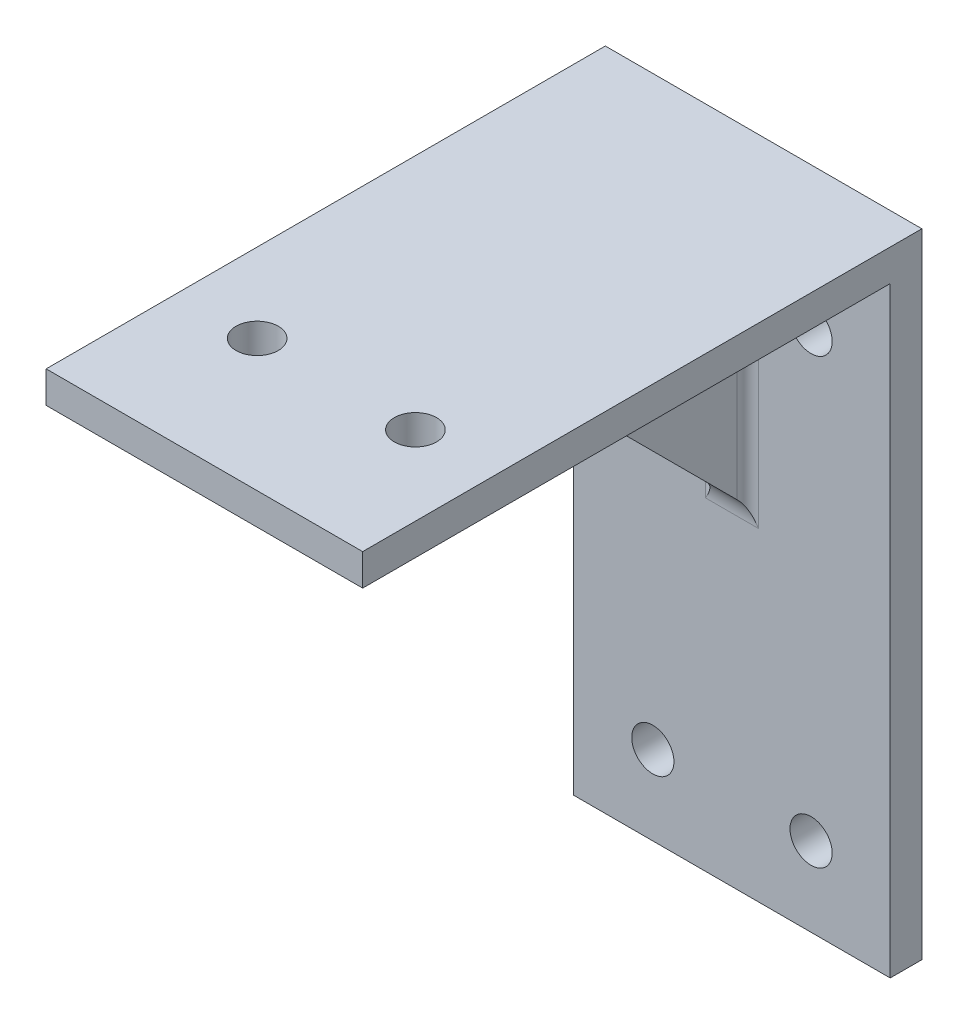
from build123d import *

# Parameters (mm, degrees)
SKETCH1_W           = 120
SKETCH1_H           = 60
BOSS_EXTRUDE1_DEPTH = 6
SKETCH2_W           = 60
SKETCH2_H           = 100
BOSS_EXTRUDE2_DEPTH = 6
BOSS_EXTRUDE3_DEPTH = 3
SKETCH5_R           = 4
CUT_EXTRUDE2_DEPTH  = 62
SKETCH6_R           = 4
CUT_EXTRUDE3_DEPTH  = 62
FILLET1_R           = 2
FILLET3_R           = 6.5


with BuildPart() as part:
    # Sketch1 → Boss-Extrude1 (new body)
    with BuildSketch(Plane(origin=(0, 0, 0), x_dir=(0, 1, 0), z_dir=(0, 0, 1))):
        Rectangle(SKETCH1_W, SKETCH1_H)
    extrude(amount=BOSS_EXTRUDE1_DEPTH)

    # Sketch2 → Boss-Extrude2 (add)
    with BuildSketch(Plane(origin=(0, 60, 0), x_dir=(-1, 0, 0), z_dir=(0, 1, 0))):
        with Locations((0, 56)):
            Rectangle(SKETCH2_W, SKETCH2_H)
    extrude(amount=-BOSS_EXTRUDE2_DEPTH)

    # Sketch4 → Boss-Extrude3 (add, symmetric)
    with BuildSketch(Plane.YZ):
        Polygon((54, 6), (4, 6), (54, 56), align=None)
    extrude(amount=BOSS_EXTRUDE3_DEPTH, both=True)

    # Sketch5 → Cut-Extrude2 (cut)
    with BuildSketch(Plane(origin=(0, 60, 0), x_dir=(-1, 0, 0), z_dir=(0, 1, 0))):
        with Locations((-15, 81)):
            Circle(SKETCH5_R)
        with Locations((15, 81)):
            Circle(SKETCH5_R)
    extrude(amount=-CUT_EXTRUDE2_DEPTH, mode=Mode.SUBTRACT)

    # Sketch6 → Cut-Extrude3 (cut)
    with BuildSketch(Plane.XY.offset(6)):
        with Locations((-15, -45)):
            Circle(SKETCH6_R)
        with Locations((15, -45)):
            Circle(SKETCH6_R)
        with Locations((-15, 39)):
            Circle(SKETCH6_R)
        with Locations((15, 39)):
            Circle(SKETCH6_R)
    extrude(amount=-CUT_EXTRUDE3_DEPTH, mode=Mode.SUBTRACT)

    # Fillet1
    fillet1_edges = [part.edges().sort_by_distance(p)[0] for p in [
        (-3, 54, 31),
        (-3, 29, 6),
        (3, 54, 31),
        (3, 29, 6),
    ]]
    fillet(fillet1_edges, radius=FILLET1_R)

    # Fillet3
    fillet3_edges = [part.edges().sort_by_distance(p)[0] for p in [
        (0, 4, 6),
        (0, 54, 56),
    ]]
    fillet(fillet3_edges, radius=FILLET3_R)


solid = part.part
